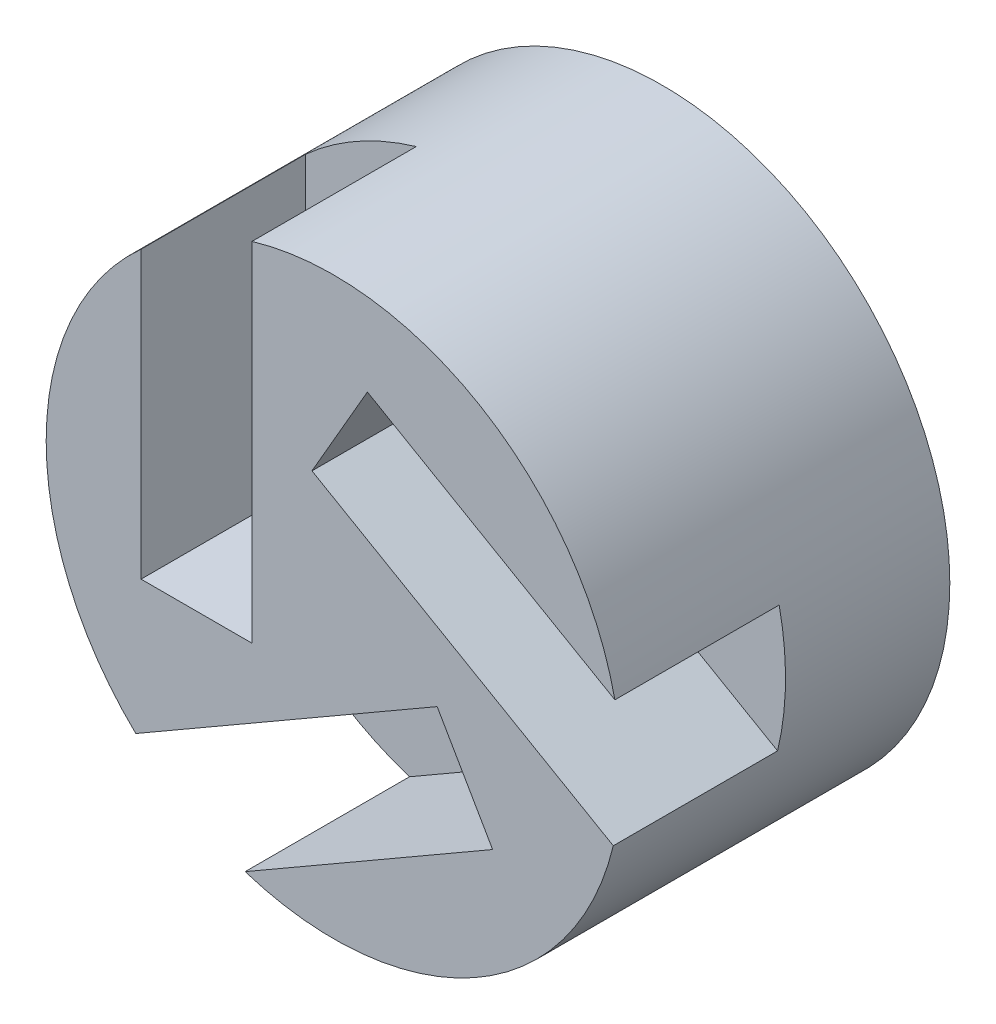
from build123d import *

# Parameters (mm, degrees)
SALIENTE_EXTRUIR1_DEPTH = 10
SALIENTE_EXTRUIR2_START = 10
CROQUIS3_R              = 17.5
SALIENTE_EXTRUIR2_DEPTH = 10
CROQUIS1_3_R            = 1.625
CORTAR_EXTRUIR4_DEPTH   = 10
SALIENTE_EXTRUIR3_START = -10
SALIENTE_EXTRUIR3_DEPTH = 10


with BuildPart() as part:
    # Croquis1 → Saliente-Extruir1 (new body)
    with BuildSketch(Plane.XY):
        with BuildLine():
            Line((6.407309398, -1.697785417), (10.082309398, -8.063072135))
            Line((10.082309398, -8.063072135), (-4.999614275, -16.770624827))
            ThreePointArc((-4.999614275, -16.770624827), (8.602870321, -15.239442977), (16.941884153, -4.384354154))
            Line((16.941884153, -4.384354154), (-1.733329398, 6.397785417))
            Line((-1.733329398, 6.397785417), (1.941670602, 12.763072135))
            Line((1.941670602, 12.763072135), (17.023594275, 4.055519442))
            ThreePointArc((17.023594275, 4.055519442), (8.896309597, 15.070025732), (-4.67398, 16.864279141))
            Line((-4.67398, 16.864279141), (-4.67398, -4.7))
            Line((-4.67398, -4.7), (-12.02398, -4.7))
            Line((-12.02398, -4.7), (-12.02398, 12.715105385))
            ThreePointArc((-12.02398, 12.715105385), (-17.499179918, 0.169417245), (-12.267904153, -12.479924987))
            Line((-12.267904153, -12.479924987), (6.407309398, -1.697785417))
        make_face()
    extrude(amount=SALIENTE_EXTRUIR1_DEPTH)

    # Croquis3 → Saliente-Extruir2 (add)
    with BuildSketch(Plane(origin=(0, 0, 0), x_dir=(-1, 0, 0), z_dir=(0, 0, -1)).offset(SALIENTE_EXTRUIR2_START)):
        Circle(CROQUIS3_R)
    extrude(amount=-SALIENTE_EXTRUIR2_DEPTH)

    # Croquis1<3> → Cortar-Extruir4 (cut)
    with BuildSketch(Plane.XY):
        with Locations((-8.34898, 3.8)):
            Circle(CROQUIS1_3_R)
        with Locations((7.465386534, 5.330428776)):
            Circle(CROQUIS1_3_R)
        with Locations((0.883593466, -9.130428776)):
            Circle(CROQUIS1_3_R)
    extrude(amount=-CORTAR_EXTRUIR4_DEPTH, mode=Mode.SUBTRACT)

    # Croquis4 → Saliente-Extruir3 (add)
    with BuildSketch(Plane.XY.offset(10).offset(SALIENTE_EXTRUIR3_START)):
        with BuildLine():
            ThreePointArc((-4.67398, 16.864279141), (-4.824171793, 16.821931117), (-4.97398, 16.778245527))
            Line((-4.97398, 16.778245527), (-4.97398, -4.4))
            Line((-4.97398, -4.4), (-11.72398, -4.4))
            Line((-11.72398, -4.4), (-11.72398, 12.992239721))
            ThreePointArc((-11.72398, 12.992239721), (-11.874788499, 12.854547759), (-12.02398, 12.715105385))
            Line((-12.02398, 12.715105385), (-12.02398, -4.7))
            Line((-12.02398, -4.7), (-4.67398, -4.7))
            Line((-4.67398, -4.7), (-4.67398, 16.864279141))
        make_face()
        with BuildLine():
            ThreePointArc((17.11359965, 3.657144653), (17.069759163, 3.856594625), (17.023594275, 4.055519442))
            Line((17.023594275, 4.055519442), (1.941670602, 12.763072135))
            Line((1.941670602, 12.763072135), (-1.733329398, 6.397785417))
            Line((-1.733329398, 6.397785417), (16.941884153, -4.384354154))
            ThreePointArc((16.941884153, -4.384354154), (16.980305585, -4.233110234), (17.017376857, -4.081529726))
            Line((17.017376857, -4.081529726), (-1.323521777, 6.507593038))
            Line((-1.323521777, 6.507593038), (2.051478223, 12.353264513))
            Line((2.051478223, 12.353264513), (17.11359965, 3.657144653))
        make_face()
        with BuildLine():
            Line((6.407309398, -1.697785417), (-12.267904153, -12.479924987))
            ThreePointArc((-12.267904153, -12.479924987), (-12.156133792, -12.588820883), (-12.043396857, -12.696715801))
            Line((-12.043396857, -12.696715801), (6.297501777, -2.107593038))
            Line((6.297501777, -2.107593038), (9.672501777, -7.953264513))
            Line((9.672501777, -7.953264513), (-5.38961965, -16.649384374))
            ThreePointArc((-5.38961965, -16.649384374), (-5.194970664, -16.711142385), (-4.999614275, -16.770624827))
            Line((-4.999614275, -16.770624827), (10.082309398, -8.063072135))
            Line((10.082309398, -8.063072135), (6.407309398, -1.697785417))
        make_face()
    extrude(amount=SALIENTE_EXTRUIR3_DEPTH)


solid = part.part
